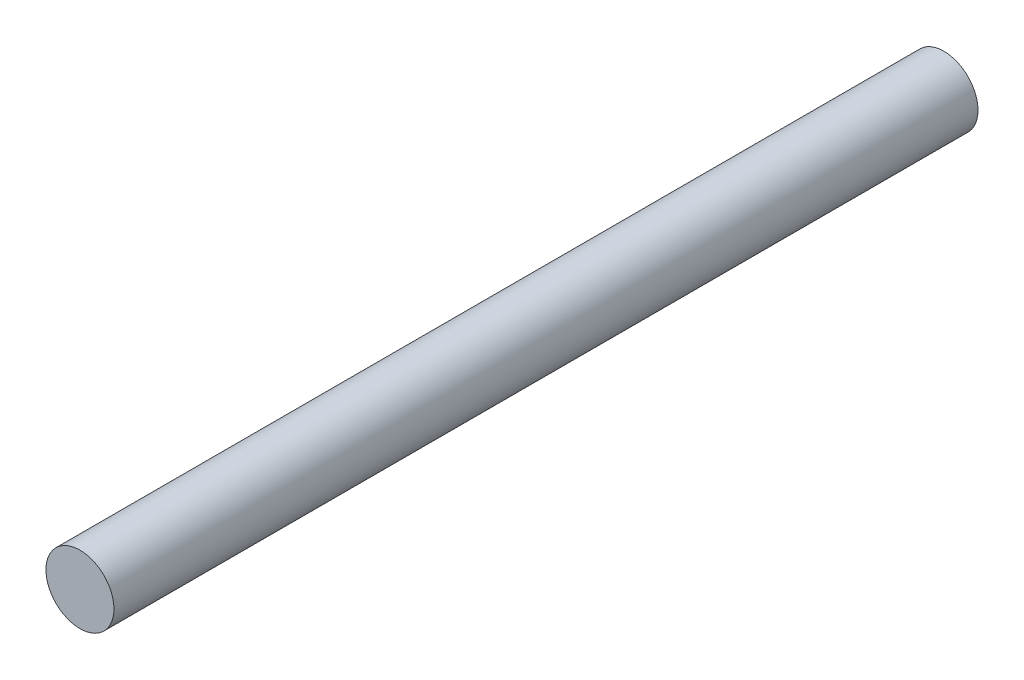
from build123d import *

# Parameters (mm, degrees)
SKETCH4_R           = 4
BOSS_EXTRUDE1_DEPTH = 101.6


with BuildPart() as part:
    # Sketch4 → Boss-Extrude1 (new body)
    with BuildSketch(Plane.XY.offset(88.9)):
        Circle(SKETCH4_R)
    extrude(amount=BOSS_EXTRUDE1_DEPTH)


solid = part.part
